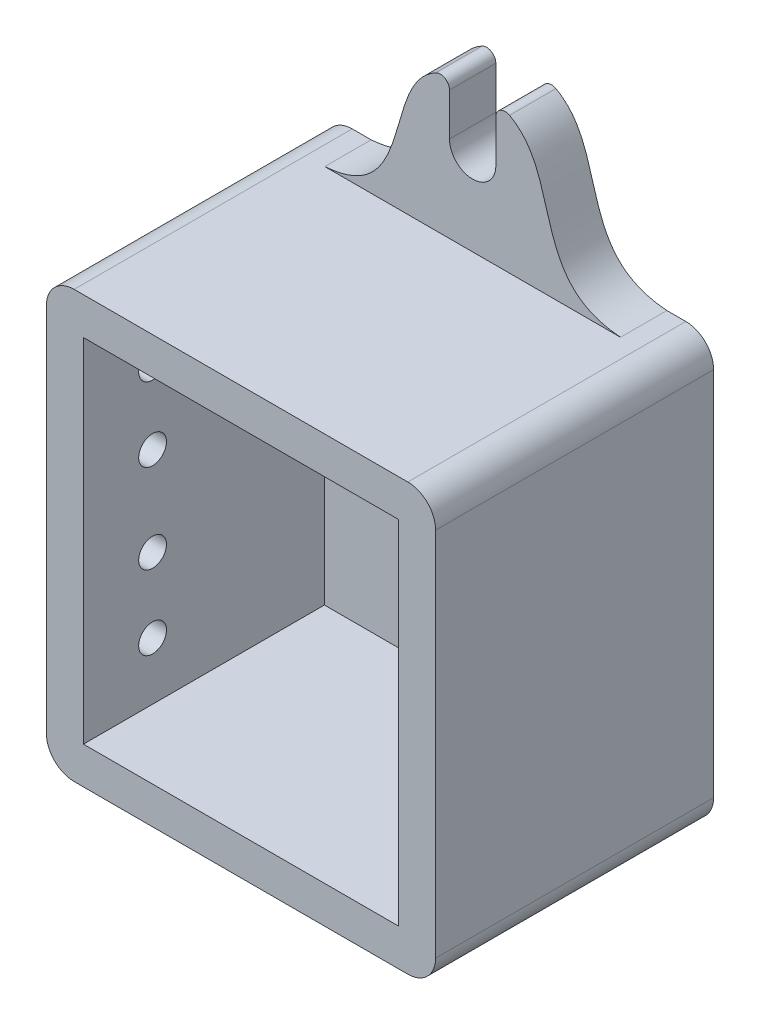
from build123d import *

# Parameters (mm, degrees)
SCHIZZO1_W                   = 42
SCHIZZO1_H                   = 46
SCHIZZO1_W_2                 = 34
SCHIZZO1_H_2                 = 38
ESTRUSIONE_SOTTILE1_DEPTH    = 30
SCHIZZO2_W                   = 42
SCHIZZO2_H                   = 46
ESTRUSIONE_ESTRUSIONE1_DEPTH = 4
SCHIZZO4_R                   = 1.5
TAGLIO_ESTRUSIONE1_DEPTH     = 4
RACCORDO1_R                  = 3
RACCORDO2_R                  = 3
RACCORDO3_R                  = 3
RACCORDO4_R                  = 3
ESTRUSIONE_ESTRUSIONE3_DEPTH = 5


with BuildPart() as part:
    # Schizzo1 → Estrusione-Sottile1 (new body)
    with BuildSketch(Plane.XY):
        Rectangle(SCHIZZO1_W, SCHIZZO1_H)
        Rectangle(SCHIZZO1_W_2, SCHIZZO1_H_2, mode=Mode.SUBTRACT)
    extrude(amount=ESTRUSIONE_SOTTILE1_DEPTH)

    # Schizzo2 → Estrusione-Estrusione1 (add)
    with BuildSketch(Plane.XY):
        Rectangle(SCHIZZO2_W, SCHIZZO2_H)
    extrude(amount=ESTRUSIONE_ESTRUSIONE1_DEPTH)

    # Schizzo4 → Taglio-Estrusione1 (cut)
    with BuildSketch(Plane.ZY.offset(21)):
        with Locations((22.540727145, 12.794949591)):
            Circle(SCHIZZO4_R)
        with Locations((22.540727145, 4.794949591)):
            Circle(SCHIZZO4_R)
        with Locations(Location((22.540727145, -4.794949591, 0), (0, 0, 180))):
            Circle(SCHIZZO4_R)
        with Locations(Location((22.540727145, -12.794949591, 0), (0, 0, 180))):
            Circle(SCHIZZO4_R)
    extrude(amount=-TAGLIO_ESTRUSIONE1_DEPTH, mode=Mode.SUBTRACT)

    # Raccordo1
    raccordo1_edges = [part.edges().sort_by_distance(p)[0] for p in [
        (-21, -23, 15),
    ]]
    fillet(raccordo1_edges, radius=RACCORDO1_R)

    # Raccordo2
    raccordo2_edges = [part.edges().sort_by_distance(p)[0] for p in [
        (21, -23, 15),
    ]]
    fillet(raccordo2_edges, radius=RACCORDO2_R)

    # Raccordo3
    raccordo3_edges = [part.edges().sort_by_distance(p)[0] for p in [
        (21, 23, 15),
    ]]
    fillet(raccordo3_edges, radius=RACCORDO3_R)

    # Raccordo4
    raccordo4_edges = [part.edges().sort_by_distance(p)[0] for p in [
        (-21, 23, 15),
    ]]
    fillet(raccordo4_edges, radius=RACCORDO4_R)

    # Schizzo3 → Estrusione-Estrusione3 (add)
    with BuildSketch(Plane.XY):
        with BuildLine():
            Line((-15.956647945, 23), (15.956647945, 23))
            add(Edge.make_bspline(
                [(15.956647945, 23), (8.114099812, 23.565784933), (9.021988807, 32.329235039), (5.183827034, 37.096841948), (3.979062469, 37.754360864)],
                knots=[0, 0, 0, 0, 0.676224636, 0.852915934, 0.852915934, 0.852915934, 0.852915934], degree=3))
            ThreePointArc((3.979062469, 37.754360864), (2.989638593, 37.736540073), (2.5, 36.876580054))
            Line((2.5, 36.876580054), (2.5, 32.299789094))
            ThreePointArc((2.5, 32.299789094), (0, 29.799789094), (-2.5, 32.299789094))
            Line((-2.5, 32.299789094), (-2.5, 36.876580054))
            ThreePointArc((-2.5, 36.876580054), (-2.989638593, 37.736540073), (-3.979062469, 37.754360864))
            add(Edge.make_bspline(
                [(-15.956647945, 23), (-8.114099812, 23.565784933), (-9.021988807, 32.329235039), (-5.183827034, 37.096841948), (-3.979062469, 37.754360864)],
                knots=[0, 0, 0, 0, 0.676224636, 0.852915934, 0.852915934, 0.852915934, 0.852915934], degree=3))
        make_face()
        with BuildLine():
            Line((2.5, -32.299789094), (2.5, -36.876580054))
            ThreePointArc((2.5, -36.876580054), (2.989638593, -37.736540073), (3.979062469, -37.754360864))
            add(Edge.make_bspline(
                [(15.956647945, -23), (8.114099812, -23.565784933), (9.021988807, -32.329235039), (5.183827034, -37.096841948), (3.979062469, -37.754360864)],
                knots=[0, 0, 0, 0, 0.676224636, 0.852915934, 0.852915934, 0.852915934, 0.852915934], degree=3))
            Line((15.956647945, -23), (-15.956647945, -23))
            add(Edge.make_bspline(
                [(-15.956647945, -23), (-8.114099812, -23.565784933), (-9.021988807, -32.329235039), (-5.183827034, -37.096841948), (-3.979062469, -37.754360864)],
                knots=[0, 0, 0, 0, 0.676224636, 0.852915934, 0.852915934, 0.852915934, 0.852915934], degree=3))
            ThreePointArc((-3.979062469, -37.754360864), (-2.989638593, -37.736540073), (-2.5, -36.876580054))
            Line((-2.5, -36.876580054), (-2.5, -32.299789094))
            ThreePointArc((-2.5, -32.299789094), (0, -29.799789094), (2.5, -32.299789094))
        make_face()
    extrude(amount=ESTRUSIONE_ESTRUSIONE3_DEPTH)


solid = part.part
